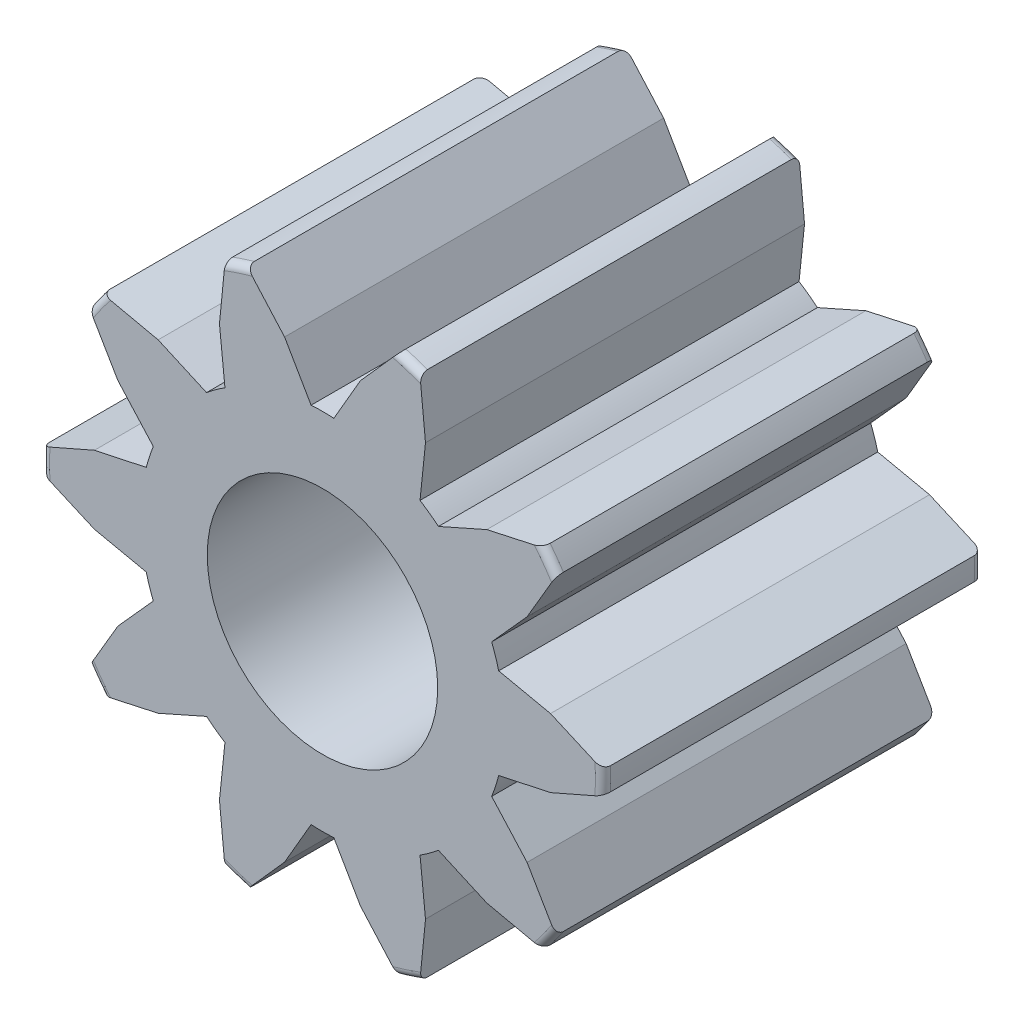
from build123d import *

# Parameters (mm, degrees)
CROQUIS1_R              = 1.85
SALIENTE_EXTRUIR1_DEPTH = 2.5
CORTAR_EXTRUIR1_DEPTH   = 2.85
REDONDEO1_R             = 0.05
MATRIZC1_COUNT          = 10
CROQUIS2_3_R            = 0.76
CORTAR_EXTRUIR2_DEPTH   = 2.85


with BuildPart() as part:
    # Croquis1 → Saliente-Extruir1 (new body)
    with BuildSketch(Plane.XY):
        Circle(CROQUIS1_R)
    extrude(amount=SALIENTE_EXTRUIR1_DEPTH)

    # Croquis2 → Cortar-Extruir1 (cut)
    with BuildSketch(Plane.XY.offset(2.5)):
        with BuildLine():
            ThreePointArc((-0.075, 1.197653957), (0, 1.2), (0.075, 1.197653957))
            Line((0.075, 1.197653957), (0.25, 1.5))
            Line((0.25, 1.5), (0.5, 1.781151313))
            Line((0.5, 1.781151313), (0.5, 2.25))
            Line((0.5, 2.25), (-0.5, 2.25))
            Line((-0.5, 2.25), (-0.5, 1.781151313))
            Line((-0.5, 1.781151313), (-0.25, 1.5))
            Line((-0.25, 1.5), (-0.075, 1.197653957))
        make_face()
    cortar_extruir1 = extrude(amount=-CORTAR_EXTRUIR1_DEPTH, mode=Mode.SUBTRACT)

    # Redondeo1
    redondeo1_edges = [part.edges().sort_by_distance(p)[0] for p in [
        (0, -1.85, 0),
        (0, -1.85, 2.5),
    ]]
    fillet(redondeo1_edges, radius=REDONDEO1_R)

    # MatrizC1: Cortar-Extruir1 ×10 about axis
    matrizc1_axis = Axis((0, 0, 2.5), (0, 0, -1))
    for i in range(1, MATRIZC1_COUNT):
        add(cortar_extruir1.rotate(matrizc1_axis, i * 360 / MATRIZC1_COUNT), mode=Mode.SUBTRACT)

    # Croquis2<3> → Cortar-Extruir2 (cut)
    with BuildSketch(Plane.XY.offset(2.5)):
        Circle(CROQUIS2_3_R)
    extrude(amount=-CORTAR_EXTRUIR2_DEPTH, mode=Mode.SUBTRACT)


solid = part.part
